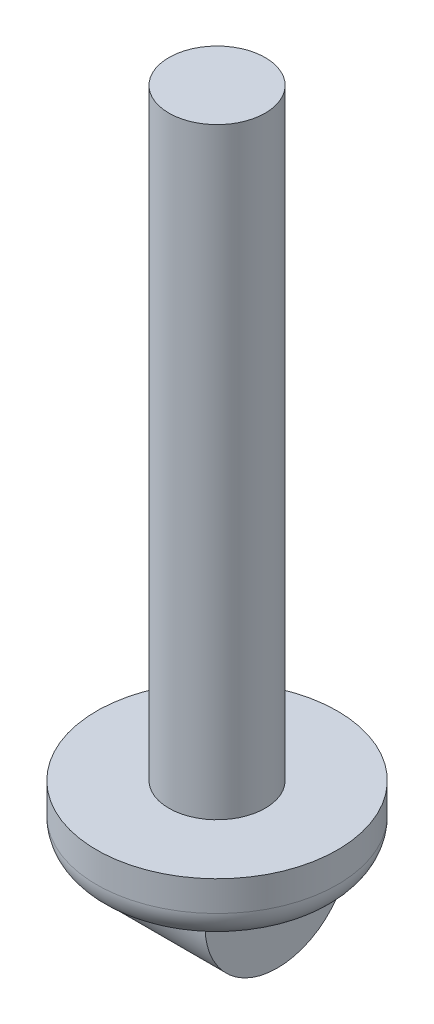
from build123d import *

# Parameters (mm, degrees)
SKETCH1_R           = 4
BOSS_EXTRUDE1_DEPTH = 50
SKETCH3_R           = 10
BOSS_EXTRUDE2_DEPTH = 5
FILLET1_R           = 2.5
BOSS_EXTRUDE3_DEPTH = 5


with BuildPart() as part:
    # Sketch1 → Boss-Extrude1 (new body)
    with BuildSketch(Plane(origin=(0, 0, 0), x_dir=(1, 0, 0), z_dir=(0, 1, 0))):
        with Locations(Location((0, 0, 0), (0, 0, 270))):
            Circle(SKETCH1_R)
    extrude(amount=BOSS_EXTRUDE1_DEPTH)

    # Sketch3 → Boss-Extrude2 (add)
    with BuildSketch(Plane.XZ):
        with Locations(Location((0, 0, 0), (0, 0, 270))):
            Circle(SKETCH3_R)
    extrude(amount=BOSS_EXTRUDE2_DEPTH)

    # Fillet1
    fillet1_edges = [part.edges().sort_by_distance(p)[0] for p in [
        (0, -5, 10),
    ]]
    fillet(fillet1_edges, radius=FILLET1_R)

    # Sketch4 → Boss-Extrude3 (add, symmetric)
    with BuildSketch(Plane(origin=(0, 0, 0), x_dir=(0, 0, -1), z_dir=(1, 0, 0))):
        with BuildLine():
            Line((-6, -5), (6, -5))
            ThreePointArc((6, -5), (0, -11), (-6, -5))
        make_face()
    extrude(amount=BOSS_EXTRUDE3_DEPTH, both=True)


solid = part.part
